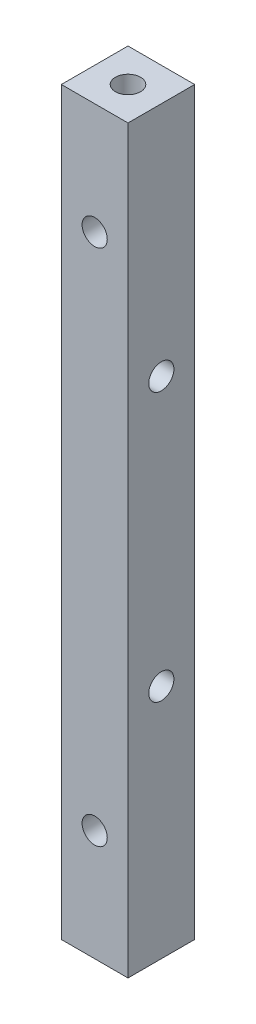
from build123d import *

# Parameters (mm, degrees)
SKETCH1_W                     = 9.144
SKETCH1_H                     = 9.144
BOSS_EXTRUDE1_DEPTH           = 101.6
TAP_DRILL_FOR_8_32_TAP1_D     = 3.4544
TAP_DRILL_FOR_8_32_TAP2_D     = 3.4544
TAP_DRILL_FOR_8_32_TAP3_D     = 3.4544
TAP_DRILL_FOR_8_32_TAP3_DEPTH = 7.62
TAP_DRILL_FOR_8_32_TAP3_TIP   = 1.037806461


with BuildPart() as part:
    # Sketch1 → Boss-Extrude1 (new body)
    with BuildSketch(Plane(origin=(0, 0, 0), x_dir=(1, 0, 0), z_dir=(0, 1, 0))):
        Rectangle(SKETCH1_W, SKETCH1_H)
    extrude(amount=BOSS_EXTRUDE1_DEPTH)

    # Tap Drill for #8-32 Tap1 (through all)
    with Locations(Plane.XY.offset(4.572)):
        with Locations((0, 86.36), (0, 15.24)):
            Hole(TAP_DRILL_FOR_8_32_TAP1_D / 2)

    # Tap Drill for #8-32 Tap2 (through all)
    with Locations(Plane(origin=(4.572, 0, 0), x_dir=(0, 0, -1), z_dir=(1, 0, 0))):
        with Locations((0, 69.215), (0, 32.385)):
            Hole(TAP_DRILL_FOR_8_32_TAP2_D / 2)

    # Tap Drill for #8-32 Tap3
    with Locations(Plane(origin=(0, 101.6, 0), x_dir=(1, 0, 0), z_dir=(0, 1, 0))):
        with Locations((0, 0)):
            Hole(TAP_DRILL_FOR_8_32_TAP3_D / 2, depth=TAP_DRILL_FOR_8_32_TAP3_DEPTH)
            with Locations((0, 0, -(TAP_DRILL_FOR_8_32_TAP3_DEPTH + TAP_DRILL_FOR_8_32_TAP3_TIP / 2))):  # 118° drill point
                Cone(0, TAP_DRILL_FOR_8_32_TAP3_D / 2, TAP_DRILL_FOR_8_32_TAP3_TIP, mode=Mode.SUBTRACT)


solid = part.part
